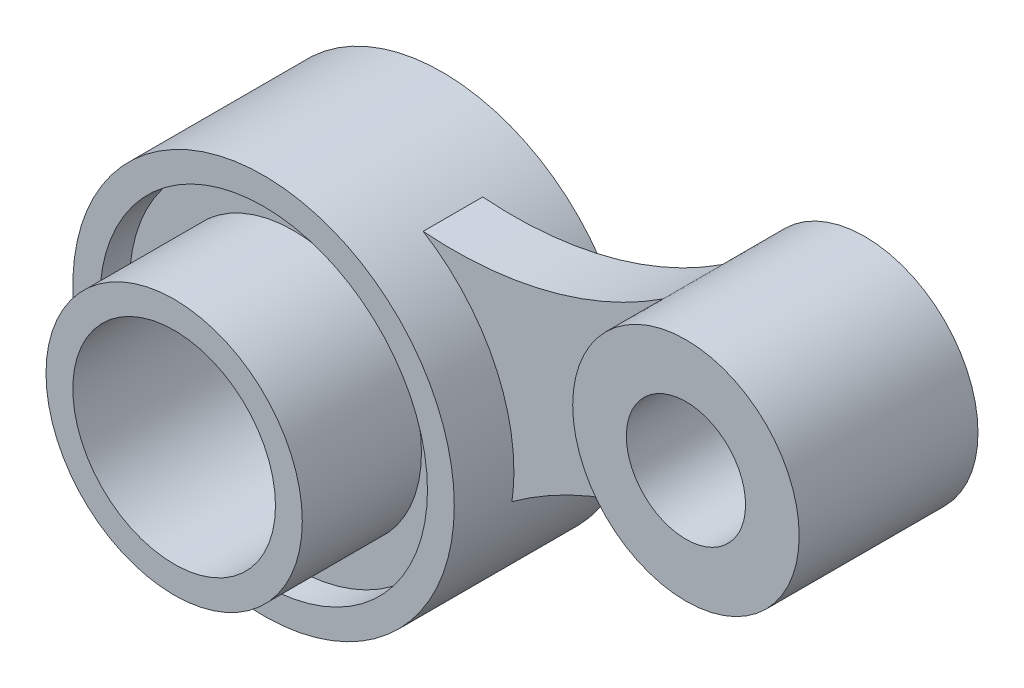
from build123d import *

# Parameters (mm, degrees)
SKETCH1_R               = 32
BOSS_EXTRUDE1_DEPTH     = 15
SKETCH1_R_2             = 19
BOSS_EXTRUDE1_2_DEPTH   = 15
BOSS_EXTRUDE2_DEPTH     = 5
CUT_EXTRUDE1_DEPTH      = 84.026980949
CUT_EXTRUDE1_DEPTH_BACK = 84.026980949
SKETCH1_4_R             = 17
SKETCH1_4_R_2           = 10
BOSS_EXTRUDE3_START     = 15
SKETCH1_5_R             = 21.5
SKETCH1_5_R_2           = 17
BOSS_EXTRUDE3_DEPTH     = 15
CUT_EXTRUDE2_DEPTH      = 87.997008946
CUT_EXTRUDE2_DEPTH_BACK = 5
CUT_EXTRUDE2_START      = 15
SKETCH1_6_R             = 27.5
SKETCH1_6_R_2           = 21.5


with BuildPart() as part:
    # Sketch1 → Boss-Extrude1 (new, symmetric)
    with BuildSketch(Plane.XY):
        with Locations((-34.339012541, -15.619481103)):
            Circle(SKETCH1_R)
    extrude(amount=BOSS_EXTRUDE1_DEPTH, both=True)



with BuildPart() as body_2:
    # Sketch1 → Boss-Extrude1 2 (new, symmetric)
    with BuildSketch(Plane.XY):
        with Locations((36.527862472, 8.934256411)):
            Circle(SKETCH1_R_2)
    extrude(amount=BOSS_EXTRUDE1_2_DEPTH, both=True)


with BuildPart() as part_1:
    add(part.part)

    add(body_2.part)  # Boss-Extrude2 merges body 2
    # Sketch1<3> → Boss-Extrude2 (add, symmetric)
    with BuildSketch(Plane.XY):
        with BuildLine():
            ThreePointArc((-17.560856981, 11.629252739), (-6.402468571, -0.013408214), (-2.339012541, -15.619481103))
            ThreePointArc((-2.339012541, -15.619481103), (-2.421245933, -17.912115996), (-2.667523463, -20.192967692))
            ThreePointArc((-2.667523463, -20.192967692), (12.135506322, -12.174986093), (28.517182449, -8.294469763))
            ThreePointArc((28.517182449, -8.294469763), (17.876719368, 5.310051543), (22.64811714, 21.909335198))
            ThreePointArc((22.64811714, 21.909335198), (3.400059206, 13.419502104), (-17.560856981, 11.629252739))
        make_face()
    extrude(amount=BOSS_EXTRUDE2_DEPTH, both=True)

    # Sketch1<4> → Cut-Extrude1 (cut, two sides: drawn at the far end of the back side and taken through both)
    with BuildSketch(Plane.XY.offset(-CUT_EXTRUDE1_DEPTH_BACK)):
        with Locations((-34.339012541, -15.619481103)):
            Circle(SKETCH1_4_R)
        with Locations((36.527862472, 8.934256411)):
            Circle(SKETCH1_4_R_2)
    extrude(amount=CUT_EXTRUDE1_DEPTH + CUT_EXTRUDE1_DEPTH_BACK, mode=Mode.SUBTRACT)

    # Sketch1<5> → Boss-Extrude3 (add)
    with BuildSketch(Plane.XY.offset(BOSS_EXTRUDE3_START)):
        with Locations((-34.339012541, -15.619481103)):
            Circle(SKETCH1_5_R)
        with Locations((-34.339012541, -15.619481103)):
            Circle(SKETCH1_5_R_2, mode=Mode.SUBTRACT)
    extrude(amount=BOSS_EXTRUDE3_DEPTH)

    # Sketch1<6> → Cut-Extrude2 (cut, two sides: drawn at the far end of the back side and taken through both)
    with BuildSketch(Plane.XY.offset(CUT_EXTRUDE2_START - CUT_EXTRUDE2_DEPTH_BACK)):
        with Locations((-34.339012541, -15.619481103)):
            Circle(SKETCH1_6_R)
        with Locations((-34.339012541, -15.619481103)):
            Circle(SKETCH1_6_R_2, mode=Mode.SUBTRACT)
    extrude(amount=CUT_EXTRUDE2_DEPTH + CUT_EXTRUDE2_DEPTH_BACK, mode=Mode.SUBTRACT)


solid = part_1.part
